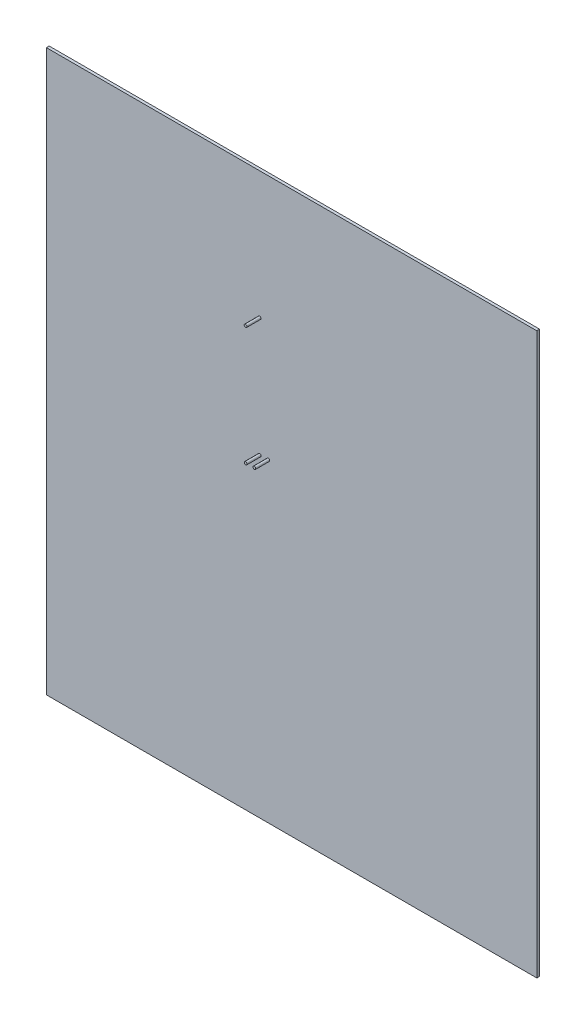
from build123d import *

# Parameters (mm, degrees)
ESBO_O1_W                = 350
ESBO_O1_H                = 400
RESSALTO_EXTRUS_O1_DEPTH = 2
ESBO_O2_R                = 1
RESSALTO_EXTRUS_O2_DEPTH = 10


with BuildPart() as part:
    # Esboço1 → Ressalto-extrusão1 (new body)
    with BuildSketch(Plane.XY):
        Rectangle(ESBO_O1_W, ESBO_O1_H)
    extrude(amount=RESSALTO_EXTRUS_O1_DEPTH)

    # Esboço2 → Ressalto-extrusão2 (add)
    with BuildSketch(Plane.XY.offset(2)):
        with Locations(Location((-16.6, 24.5, 0), (0, 0, 180))):
            Circle(ESBO_O2_R)
        with Locations(Location((-22.77, 24.27, 0), (0, 0, 180))):
            Circle(ESBO_O2_R)
        with Locations(Location((-22.83, 109.16, 0), (0, 0, 180))):
            Circle(ESBO_O2_R)
    extrude(amount=RESSALTO_EXTRUS_O2_DEPTH)


solid = part.part
